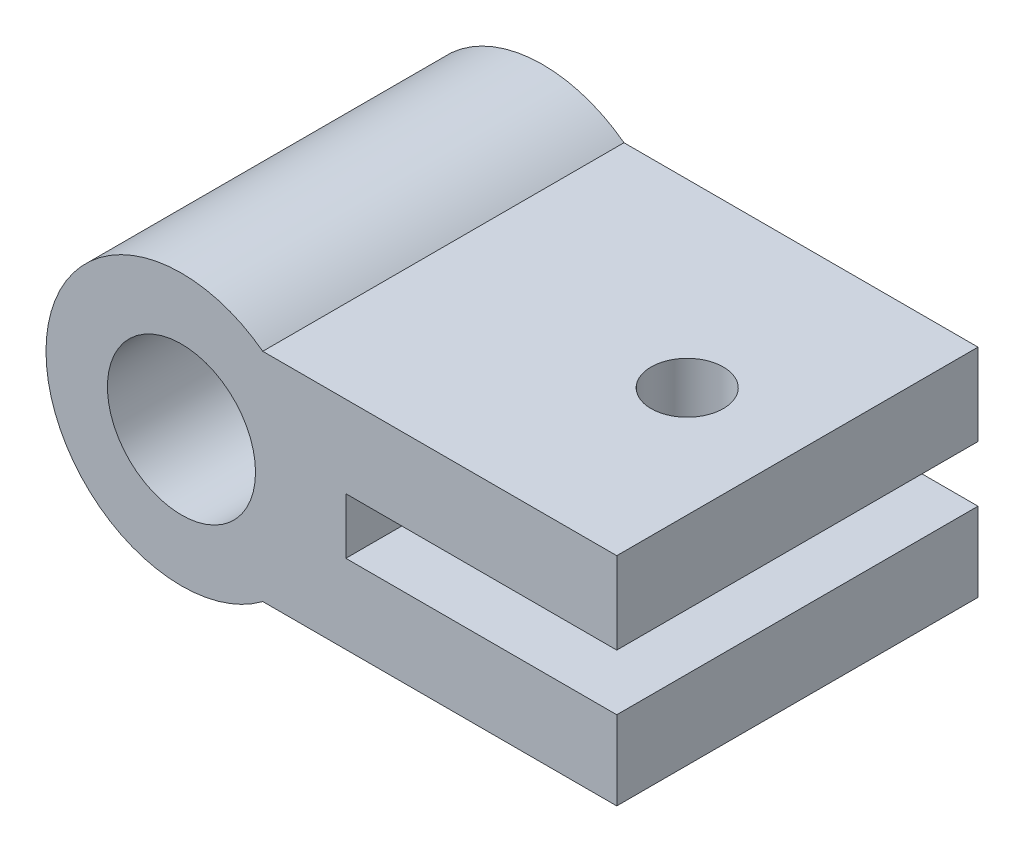
from build123d import *

# Parameters (mm, degrees)
SKETCH_1_R           = 7.5
SKETCH_1_R_2         = 4.1
EXTRUDE_1_DEPTH      = 20
EXTRUDE_2_DEPTH      = 6
EXTRUDE_2_DEPTH_BACK = 6
SKETCH_2_W           = 20
SKETCH_2_H           = 20
SKETCH_2_R           = 2
SKETCH_3_W           = 20
SKETCH_3_H           = 3.1
CUT_EXTRUDE_1_DEPTH  = 15


with BuildPart() as part:
    # 草图1 → 凸台-拉伸1 (new body)
    with BuildSketch(Plane.XY):
        Circle(SKETCH_1_R)
        Circle(SKETCH_1_R_2, mode=Mode.SUBTRACT)
    extrude(amount=EXTRUDE_1_DEPTH)

    # 草图2 → 凸台-拉伸2 (add, two sides: drawn at the far end of the back side and taken through both)
    with BuildSketch(Plane(origin=(0, 0, 0), x_dir=(1, 0, 0), z_dir=(0, 1, 0)).offset(-EXTRUDE_2_DEPTH_BACK)):
        with Locations((14.1, -10)):
            Rectangle(SKETCH_2_W, SKETCH_2_H)
        with Locations((18, -10)):
            Circle(SKETCH_2_R, mode=Mode.SUBTRACT)
    extrude(amount=EXTRUDE_2_DEPTH + EXTRUDE_2_DEPTH_BACK)

    # 草图3 → 切除-拉伸1 (cut)
    with BuildSketch(Plane(origin=(24.1, 0, 0), x_dir=(0, 0, -1), z_dir=(1, 0, 0))):
        with Locations((-10, -0.077105761)):
            Rectangle(SKETCH_3_W, SKETCH_3_H)
    extrude(amount=-CUT_EXTRUDE_1_DEPTH, mode=Mode.SUBTRACT)


solid = part.part
